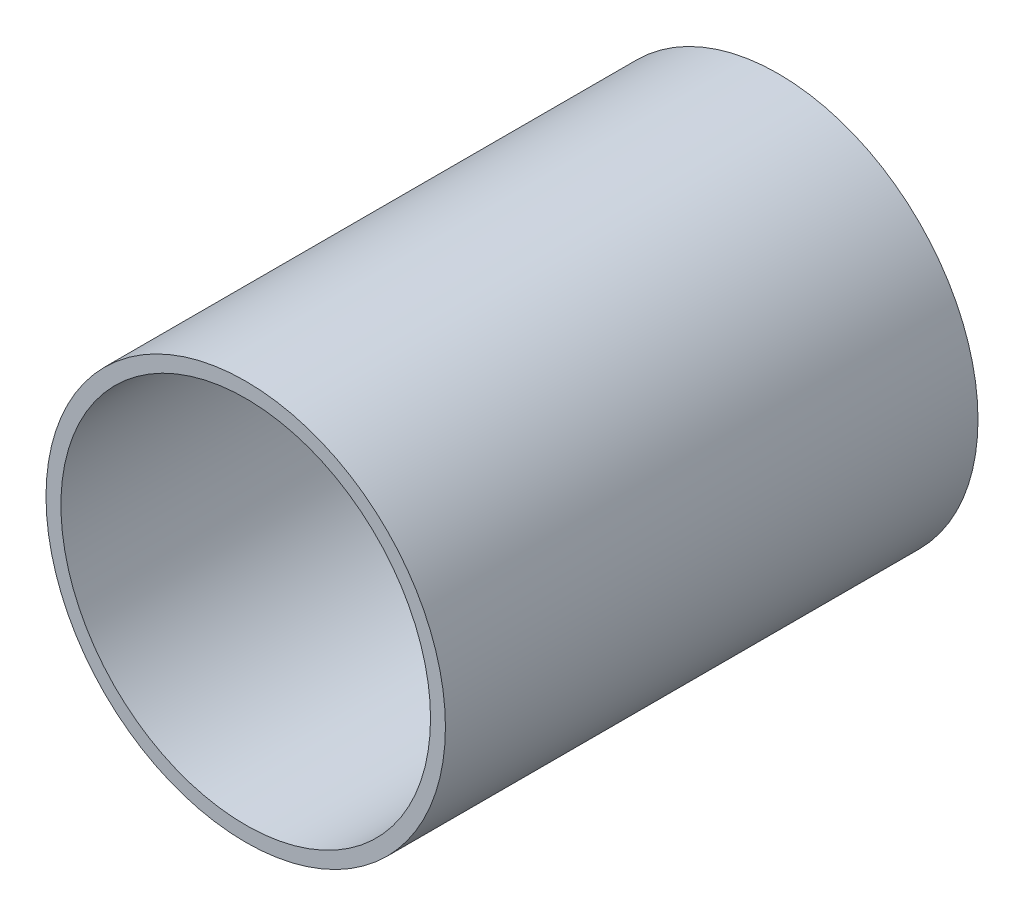
from build123d import *

# Parameters (mm, degrees)
SKETCH1_R           = 9.525
SKETCH1_R_2         = 8.8138
BOSS_EXTRUDE1_DEPTH = 25.4


with BuildPart() as part:
    # Sketch1 → Boss-Extrude1 (new body)
    with BuildSketch(Plane.XY):
        Circle(SKETCH1_R)
        Circle(SKETCH1_R_2, mode=Mode.SUBTRACT)
    extrude(amount=BOSS_EXTRUDE1_DEPTH)


solid = part.part
